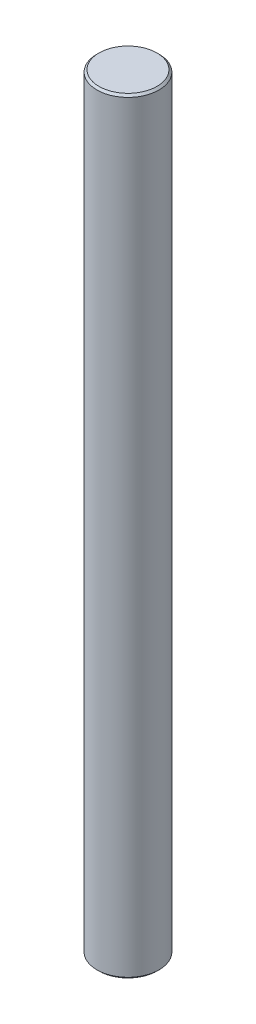
from build123d import *

# Parameters (mm, degrees)
SKETCH1_R           = 1.5
BOSS_EXTRUDE1_DEPTH = 37
CHAMFER1_SIZE       = 0.1


with BuildPart() as part:
    # Sketch1 → Boss-Extrude1 (new body)
    with BuildSketch(Plane(origin=(0, 0, 0), x_dir=(1, 0, 0), z_dir=(0, 1, 0))):
        with Locations(Location((0, 0, 0), (0, 0, 270))):
            Circle(SKETCH1_R)
    extrude(amount=BOSS_EXTRUDE1_DEPTH)

    # Chamfer1
    chamfer1_edges = [part.edges().sort_by_distance(p)[0] for p in [
        (0, 0, -1.5),
        (0, 37, -1.5),
    ]]
    chamfer(chamfer1_edges, length=CHAMFER1_SIZE)


solid = part.part
